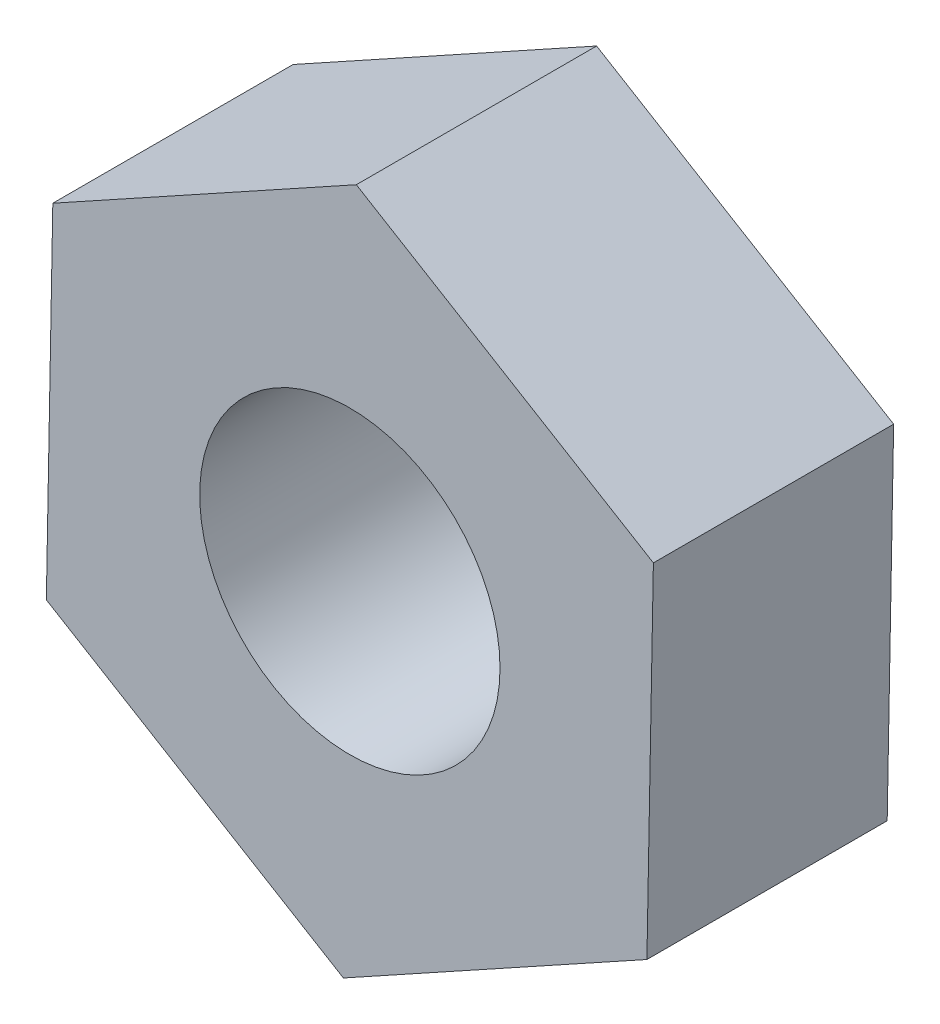
from build123d import *

# Parameters (mm, degrees)
SKETCH_1_R      = 1
EXTRUDE_1_DEPTH = 1.6


with BuildPart() as part:
    # 草图1 → 凸台-拉伸1 (new body)
    with BuildSketch(Plane.XY):
        Polygon((-1.978118968, 1.191796409), (-2.02118545, -1.117203074), (-0.043066482, -2.308999483), (1.978118968, -1.191796409), (2.02118545, 1.117203074), (0.043066482, 2.308999483), align=None)
        Circle(SKETCH_1_R, mode=Mode.SUBTRACT)
    extrude(amount=EXTRUDE_1_DEPTH)


solid = part.part
